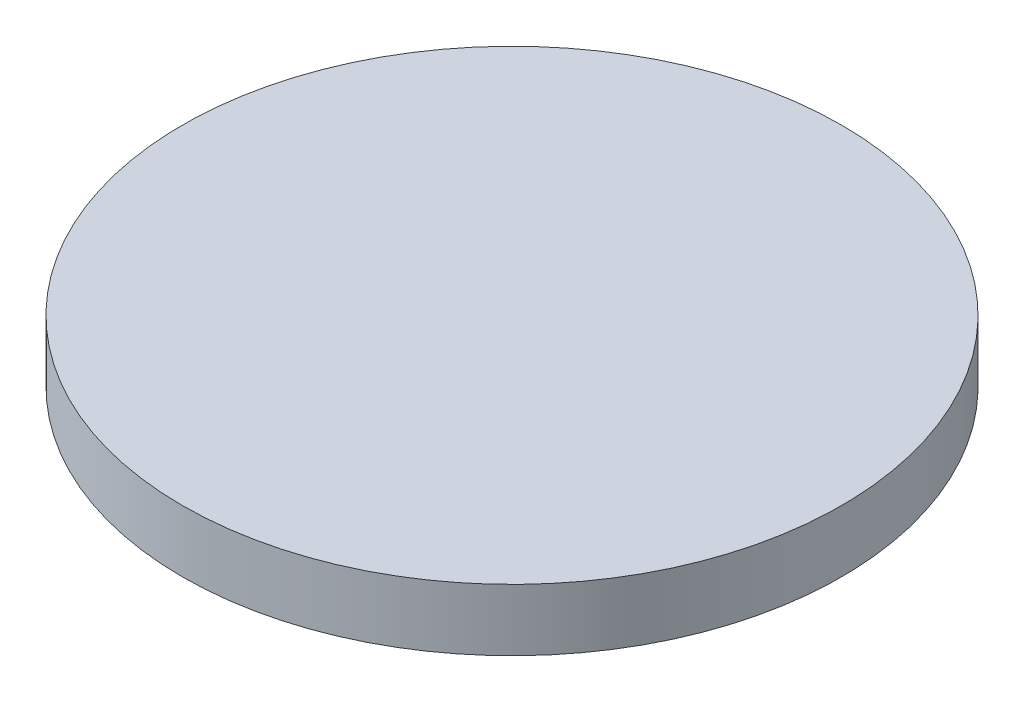
from build123d import *

# Parameters (mm, degrees)
SKETCH1_R           = 16
BOSS_EXTRUDE1_DEPTH = 3


with BuildPart() as part:
    # Sketch1 → Boss-Extrude1 (new body)
    with BuildSketch(Plane(origin=(0, 0, 0), x_dir=(1, 0, 0), z_dir=(0, 1, 0))):
        with Locations(Location((0, 0, 0), (0, 0, 270))):
            Circle(SKETCH1_R)
    extrude(amount=BOSS_EXTRUDE1_DEPTH)


solid = part.part
